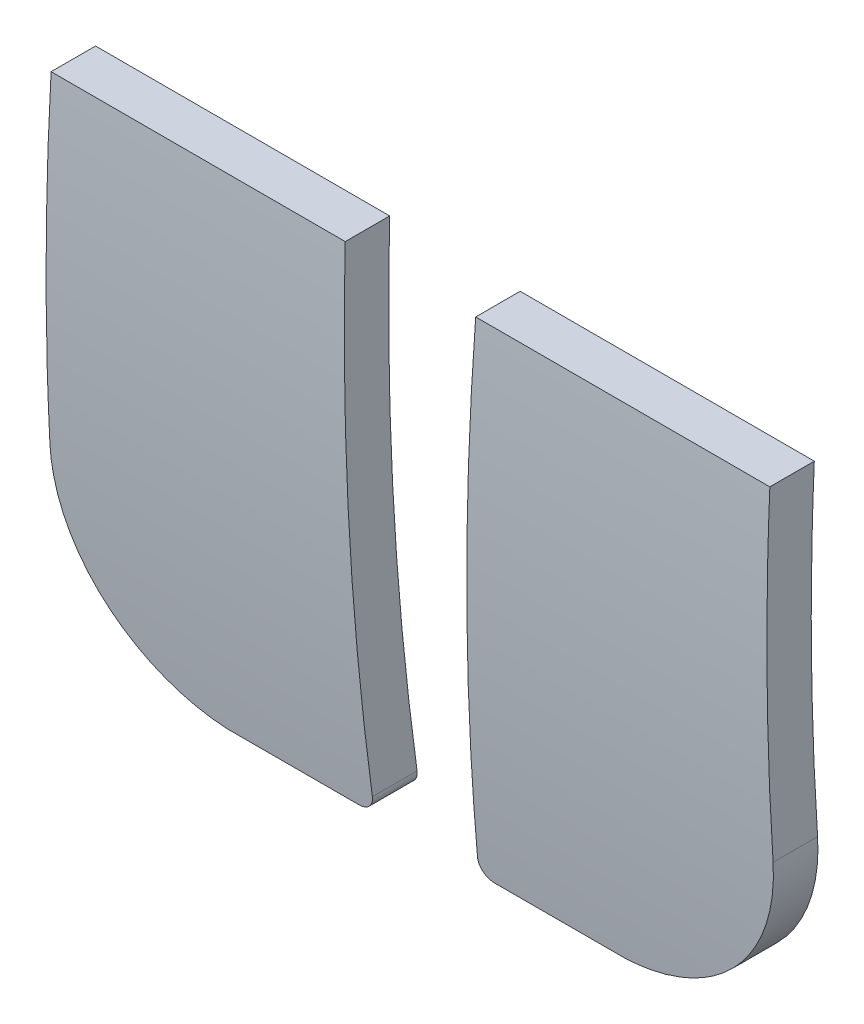
from build123d import *

# Parameters (mm, degrees)
BOSS_EXTRUDE1_DEPTH     = 111
CUT_EXTRUDE1_DEPTH      = 87
CUT_EXTRUDE1_DEPTH_BACK = 135
SKETCH3_OUTSIDE_W       = 148.268
SKETCH3_OUTSIDE_H       = 164.739
CUT_EXTRUDE2_DEPTH      = 130
KES_EKSTR_ZYON2_DEPTH   = 105


with BuildPart() as part:
    # Sketch1 → Boss-Extrude1 (new body)
    with BuildSketch(Plane.XY):
        with BuildLine():
            Line((517.664410906, 508.286343162), (517.520425715, 484.911395605))
            ThreePointArc((517.520425715, 484.911395605), (520.337490662, 477.788263307), (527.266966018, 474.52372047))
            Line((527.266966018, 474.52372047), (535.231574456, 474.52372047))
            ThreePointArc((535.231574456, 474.52372047), (535.882797488, 474.798496912), (536.140350875, 475.456721632))
            Line((536.140350875, 475.456721632), (534.767316081, 527.642772044))
            ThreePointArc((534.767316081, 527.642772044), (536.009798703, 531.011174662), (539.308986792, 532.427245709))
            ThreePointArc((539.308986792, 532.427245709), (542.608174882, 531.011174662), (543.850657504, 527.642772044))
            Line((543.850657504, 527.642772044), (542.477622709, 475.456721632))
            ThreePointArc((542.477622709, 475.456721632), (542.735176097, 474.798496912), (543.386399129, 474.52372047))
            Line((543.386399129, 474.52372047), (551.351007567, 474.52372047))
            ThreePointArc((551.351007567, 474.52372047), (558.281408258, 477.787395085), (561.097547869, 484.911395605))
            Line((561.097547869, 484.911395605), (560.953562679, 508.286343162))
            Line((560.953562679, 508.286343162), (560.734184481, 556.870055971))
            ThreePointArc((560.734184481, 556.870055971), (560.973621774, 561.417033438), (561.400829106, 565.950225271))
            Line((561.400829106, 565.950225271), (564.727256596, 601.253845235))
            ThreePointArc((564.727256596, 601.253845235), (564.61086534, 601.602450692), (564.274715543, 601.751030651))
            Line((564.274715543, 601.751030651), (543.683269376, 601.766265108))
            Line((543.683269376, 601.766265108), (542.621914123, 601.766265108))
            ThreePointArc((542.621914123, 601.766265108), (542.294228998, 601.626733985), (542.167721876, 601.293803928))
            Line((542.167721876, 601.293803928), (542.302077184, 582.505937358))
            ThreePointArc((542.302077184, 582.505937358), (539.302077184, 579.505937358), (536.302077184, 582.505937358))
            Line((536.302077184, 582.505937358), (536.436432491, 601.278569471))
            ThreePointArc((536.436432491, 601.278569471), (536.309925369, 601.611499528), (535.982240245, 601.751030651))
            Line((535.982240245, 601.751030651), (534.934704209, 601.751030651))
            Line((534.934704209, 601.751030651), (514.343258041, 601.751030651))
            ThreePointArc((514.343258041, 601.751030651), (514.007108245, 601.602450692), (513.890716989, 601.253845235))
            Line((513.890716989, 601.253845235), (517.217144479, 565.950225271))
            ThreePointArc((517.217144479, 565.950225271), (517.644351811, 561.417033438), (517.883789104, 556.870055971))
            Line((517.883789104, 556.870055971), (517.664410906, 508.286343162))
        make_face()
    extrude(amount=BOSS_EXTRUDE1_DEPTH)

    # Sketch3 outside → Cut-Extrude1 (cut, two sides: drawn at the far end of the back side and taken through both)
    with BuildSketch(Plane(origin=(563.237229272, 2.543279656, 0), x_dir=(0, 0, -1), z_dir=(0.9999898054305035, 0.004515421914267879, 0)).offset(-CUT_EXTRUDE1_DEPTH_BACK)):
        with Locations((-55.5, 535.7045)):
            Rectangle(SKETCH3_OUTSIDE_W, SKETCH3_OUTSIDE_H)
        with BuildLine():
            Line((-54.15240337, 472.029300483), (-56.84759663, 472.029300483))
            ThreePointArc((-56.84759663, 472.029300483), (-57.9806744, 487.067749831), (-57.830390264, 502.148076045))
            Line((-57.830390264, 502.148076045), (-56.463425913, 528.137009263))
            ThreePointArc((-56.463425913, 528.137009263), (-56.603102413, 538.142393826), (-58.068514869, 548.04086826))
            ThreePointArc((-58.068514869, 548.04086826), (-61.622708542, 565.163731064), (-64.874259312, 582.346633638))
            ThreePointArc((-64.874259312, 582.346633638), (-66.259909233, 590.781608006), (-67.385509377, 599.2552048))
            Line((-67.385509377, 599.2552048), (-64.690775732, 599.2552048))
            ThreePointArc((-64.690775732, 599.2552048), (-61.048172301, 576.611234839), (-55.533089644, 554.349119068))
            ThreePointArc((-55.533089644, 554.349119068), (-52.510625549, 537.211146411), (-53.299381188, 519.826576801))
            ThreePointArc((-53.299381188, 519.826576801), (-55.370891734, 495.957296403), (-54.15240337, 472.029300483))
        make_face(mode=Mode.SUBTRACT)
    extrude(amount=CUT_EXTRUDE1_DEPTH + CUT_EXTRUDE1_DEPTH_BACK, mode=Mode.SUBTRACT)

    # Sketch4 → Cut-Extrude2 (cut)
    with BuildSketch(Plane.XY):
        with BuildLine():
            Line((525.210033379, 573.07372047), (527.307940206, 573.07372047))
            ThreePointArc((527.307940206, 573.07372047), (528.434711696, 573.14721298), (529.29348257, 572.414050156))
            ThreePointArc((529.29348257, 572.414050156), (526.258986792, 564.47372047), (523.224491015, 572.414050156))
            ThreePointArc((523.224491015, 572.414050156), (524.083261888, 573.14721298), (525.210033379, 573.07372047))
        make_face()
        with BuildLine():
            Line((551.310033379, 573.07372047), (553.407940206, 573.07372047))
            ThreePointArc((553.407940206, 573.07372047), (554.534711696, 573.14721298), (555.39348257, 572.414050156))
            ThreePointArc((555.39348257, 572.414050156), (552.358986792, 564.47372047), (549.324491015, 572.414050156))
            ThreePointArc((549.324491015, 572.414050156), (550.183261888, 573.14721298), (551.310033379, 573.07372047))
        make_face()
    extrude(amount=CUT_EXTRUDE2_DEPTH, mode=Mode.SUBTRACT)

    # Çizim1 → Kes-Ekstrüzyon2 (cut, symmetric)
    with BuildSketch(Plane.XY):
        Polygon((517.641029775, 635.317918458), (477.326818539, 635.317918458), (477.326818539, 504.490586759), (517.641029775, 504.490586759), (580.201786594, 504.490586759), (580.201786594, 635.317918458), align=None)
    extrude(amount=KES_EKSTR_ZYON2_DEPTH, both=True, mode=Mode.SUBTRACT)


with BuildPart() as kes_ekstr_zyon2_piece_1:
    # of the separate pieces the step leaves, piece 1, a body of its own (kes_ekstr_zyon2_pieces)
    add(part.part.solids().sort_by_distance((543.241514721, 504.490586759, 55.156538323))[0])


with BuildPart() as kes_ekstr_zyon2_piece_2:
    # of the separate pieces the step leaves, piece 2, a body of its own (kes_ekstr_zyon2_pieces)
    add(part.part.solids().sort_by_distance((517.641029775, 504.490586759, 55.150403082))[0])


solid = Compound([kes_ekstr_zyon2_piece_1.part, kes_ekstr_zyon2_piece_2.part])
